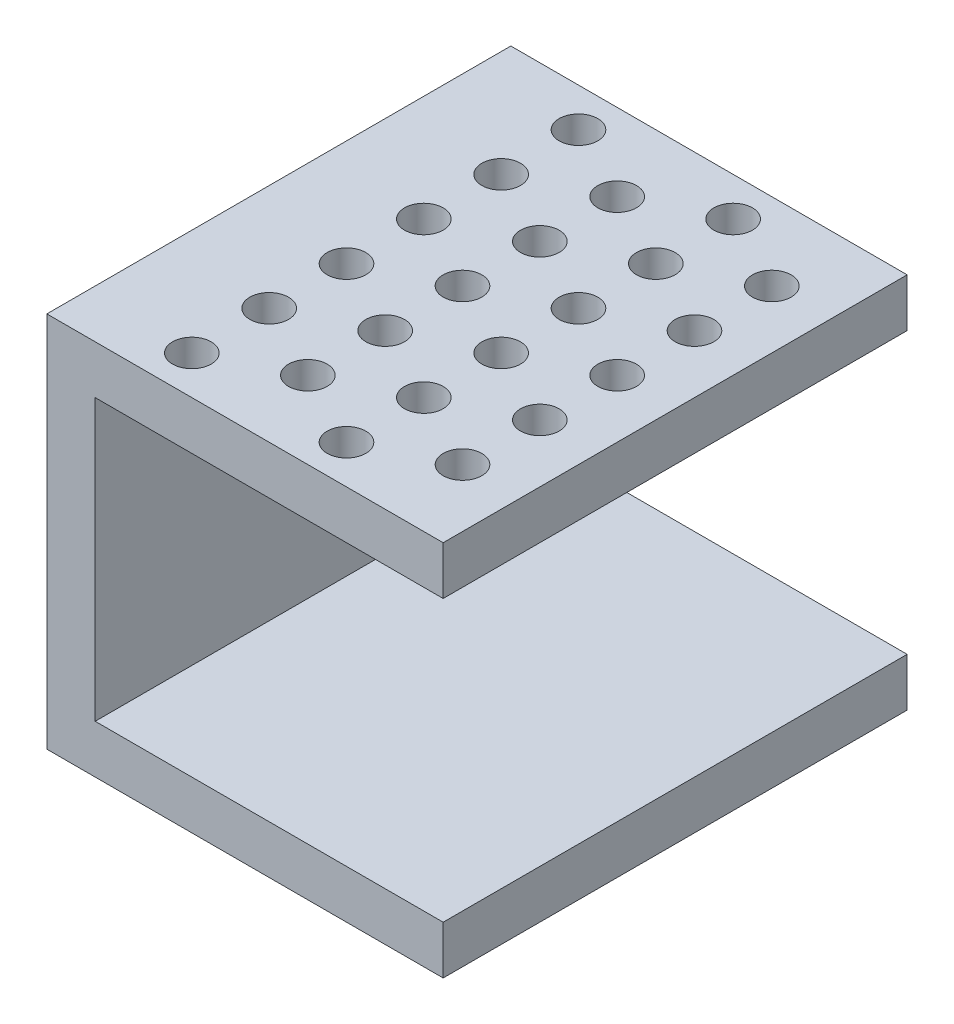
from build123d import *

# Parameters (mm, degrees)
SKETCH2_W           = 18
SKETCH2_H           = 24
SKETCH2_R           = 1
BOSS_EXTRUDE2_DEPTH = 2.5
SKETCH4_W           = 24
SKETCH4_H           = 2.5
BOSS_EXTRUDE3_DEPTH = 2.5
SKETCH6_W           = 2.5
SKETCH6_H           = 24
BOSS_EXTRUDE5_DEPTH = 17
SKETCH7_W           = 24
SKETCH7_H           = 2.5
BOSS_EXTRUDE6_DEPTH = 18


with BuildPart() as part:
    # Sketch2 → Boss-Extrude2 (new body)
    with BuildSketch(Plane(origin=(0, 0, 0), x_dir=(1, 0, 0), z_dir=(0, 1, 0))):
        with Locations((-11, 4)):
            Rectangle(SKETCH2_W, SKETCH2_H)
        with Locations(Location((-17, -6, 0), (0, 0, 270))):
            Circle(SKETCH2_R, mode=Mode.SUBTRACT)
        with Locations(Location((-17, -2, 0), (0, 0, 270))):
            Circle(SKETCH2_R, mode=Mode.SUBTRACT)
        with Locations(Location((-17, 2, 0), (0, 0, 270))):
            Circle(SKETCH2_R, mode=Mode.SUBTRACT)
        with Locations(Location((-17, 6, 0), (0, 0, 270))):
            Circle(SKETCH2_R, mode=Mode.SUBTRACT)
        with Locations(Location((-17, 10, 0), (0, 0, 270))):
            Circle(SKETCH2_R, mode=Mode.SUBTRACT)
        with Locations(Location((-17, 14, 0), (0, 0, 270))):
            Circle(SKETCH2_R, mode=Mode.SUBTRACT)
        with Locations(Location((-13, -4, 0), (0, 0, 270))):
            Circle(SKETCH2_R, mode=Mode.SUBTRACT)
        with Locations(Location((-13, 0, 0), (0, 0, 270))):
            Circle(SKETCH2_R, mode=Mode.SUBTRACT)
        with Locations(Location((-13, 4, 0), (0, 0, 270))):
            Circle(SKETCH2_R, mode=Mode.SUBTRACT)
        with Locations(Location((-13, 8, 0), (0, 0, 270))):
            Circle(SKETCH2_R, mode=Mode.SUBTRACT)
        with Locations(Location((-13, 12, 0), (0, 0, 270))):
            Circle(SKETCH2_R, mode=Mode.SUBTRACT)
        with Locations(Location((-9, -6, 0), (0, 0, 270))):
            Circle(SKETCH2_R, mode=Mode.SUBTRACT)
        with Locations(Location((-9, -2, 0), (0, 0, 270))):
            Circle(SKETCH2_R, mode=Mode.SUBTRACT)
        with Locations(Location((-9, 2, 0), (0, 0, 270))):
            Circle(SKETCH2_R, mode=Mode.SUBTRACT)
        with Locations(Location((-9, 6, 0), (0, 0, 270))):
            Circle(SKETCH2_R, mode=Mode.SUBTRACT)
        with Locations(Location((-9, 10, 0), (0, 0, 270))):
            Circle(SKETCH2_R, mode=Mode.SUBTRACT)
        with Locations(Location((-9, 14, 0), (0, 0, 270))):
            Circle(SKETCH2_R, mode=Mode.SUBTRACT)
        with Locations(Location((-5, -4, 0), (0, 0, 270))):
            Circle(SKETCH2_R, mode=Mode.SUBTRACT)
        with Locations(Location((-5, 0, 0), (0, 0, 270))):
            Circle(SKETCH2_R, mode=Mode.SUBTRACT)
        with Locations(Location((-5, 4, 0), (0, 0, 270))):
            Circle(SKETCH2_R, mode=Mode.SUBTRACT)
        with Locations(Location((-5, 8, 0), (0, 0, 270))):
            Circle(SKETCH2_R, mode=Mode.SUBTRACT)
        with Locations(Location((-5, 12, 0), (0, 0, 270))):
            Circle(SKETCH2_R, mode=Mode.SUBTRACT)
    extrude(amount=BOSS_EXTRUDE2_DEPTH)

    # Sketch4 → Boss-Extrude3 (add)
    with BuildSketch(Plane.ZY.offset(20)):
        with Locations((-4, 1.25)):
            Rectangle(SKETCH4_W, SKETCH4_H)
    extrude(amount=BOSS_EXTRUDE3_DEPTH)

    # Sketch6 → Boss-Extrude5 (add)
    with BuildSketch(Plane.XZ):
        with Locations((-21.25, -4)):
            Rectangle(SKETCH6_W, SKETCH6_H)
    extrude(amount=BOSS_EXTRUDE5_DEPTH)

    # Sketch7 → Boss-Extrude6 (add)
    with BuildSketch(Plane(origin=(-20, 0, 0), x_dir=(0, 0, -1), z_dir=(1, 0, 0))):
        with Locations((4, -15.75)):
            Rectangle(SKETCH7_W, SKETCH7_H)
    extrude(amount=BOSS_EXTRUDE6_DEPTH)


solid = part.part
